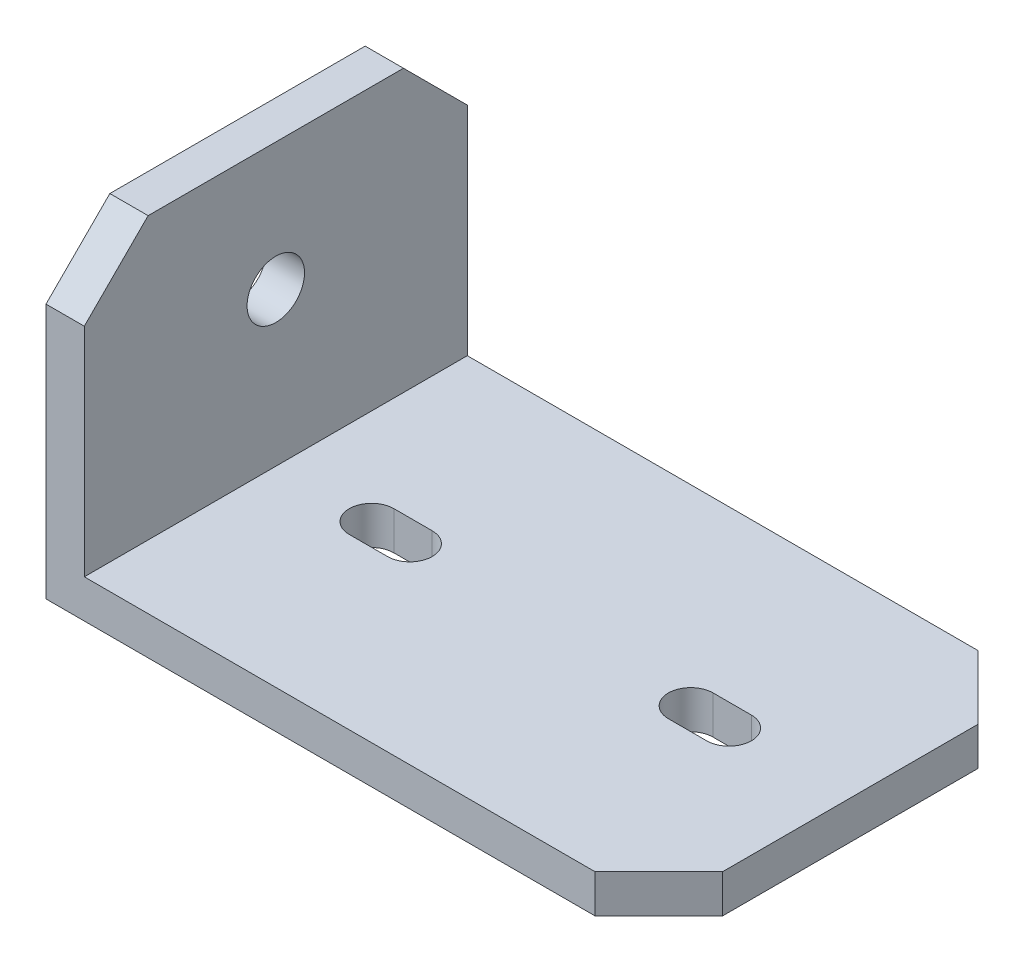
from build123d import *

# Parameters (mm, degrees)
BOSS_EXTRUDE1_DEPTH = 30
SKETCH2_R           = 2.25
CUT_EXTRUDE1_DEPTH  = 30
CUT_EXTRUDE2_DEPTH  = 30
CHAMFER1_SIZE       = 5


with BuildPart() as part:
    # Sketch1 → Boss-Extrude1 (new body)
    with BuildSketch(Plane.XY):
        Polygon((0, 22), (0, 0), (45, 0), (45, -3), (-3, -3), (-3, 22), align=None)
    extrude(amount=BOSS_EXTRUDE1_DEPTH)

    # Sketch2 → Cut-Extrude1 (cut)
    with BuildSketch(Plane(origin=(0, 0, 0), x_dir=(0, 0, -1), z_dir=(1, 0, 0))):
        with Locations(Location((-15, 12, 0), (0, 0, 90))):
            Circle(SKETCH2_R)
    extrude(amount=-CUT_EXTRUDE1_DEPTH, mode=Mode.SUBTRACT)

    # Sketch3 → Cut-Extrude2 (cut)
    with BuildSketch(Plane(origin=(0, 0, 0), x_dir=(1, 0, 0), z_dir=(0, 1, 0))):
        with BuildLine():
            Line((7.5, -13.25), (10.5, -13.25))
            ThreePointArc((10.5, -13.25), (12.25, -15), (10.5, -16.75))
            Line((10.5, -16.75), (7.5, -16.75))
            ThreePointArc((7.5, -16.75), (5.75, -15), (7.5, -13.25))
        make_face()
        with BuildLine():
            Line((32.5, -13.25), (35.5, -13.25))
            ThreePointArc((35.5, -13.25), (37.25, -15), (35.5, -16.75))
            Line((35.5, -16.75), (32.5, -16.75))
            ThreePointArc((32.5, -16.75), (30.75, -15), (32.5, -13.25))
        make_face()
    extrude(amount=-CUT_EXTRUDE2_DEPTH, mode=Mode.SUBTRACT)

    # Chamfer1
    chamfer1_edges = [part.edges().sort_by_distance(p)[0] for p in [
        (45, -1.5, 30),
        (-1.5, 22, 30),
        (45, -1.5, 0),
        (-1.5, 22, 0),
    ]]
    chamfer(chamfer1_edges, length=CHAMFER1_SIZE)


solid = part.part
